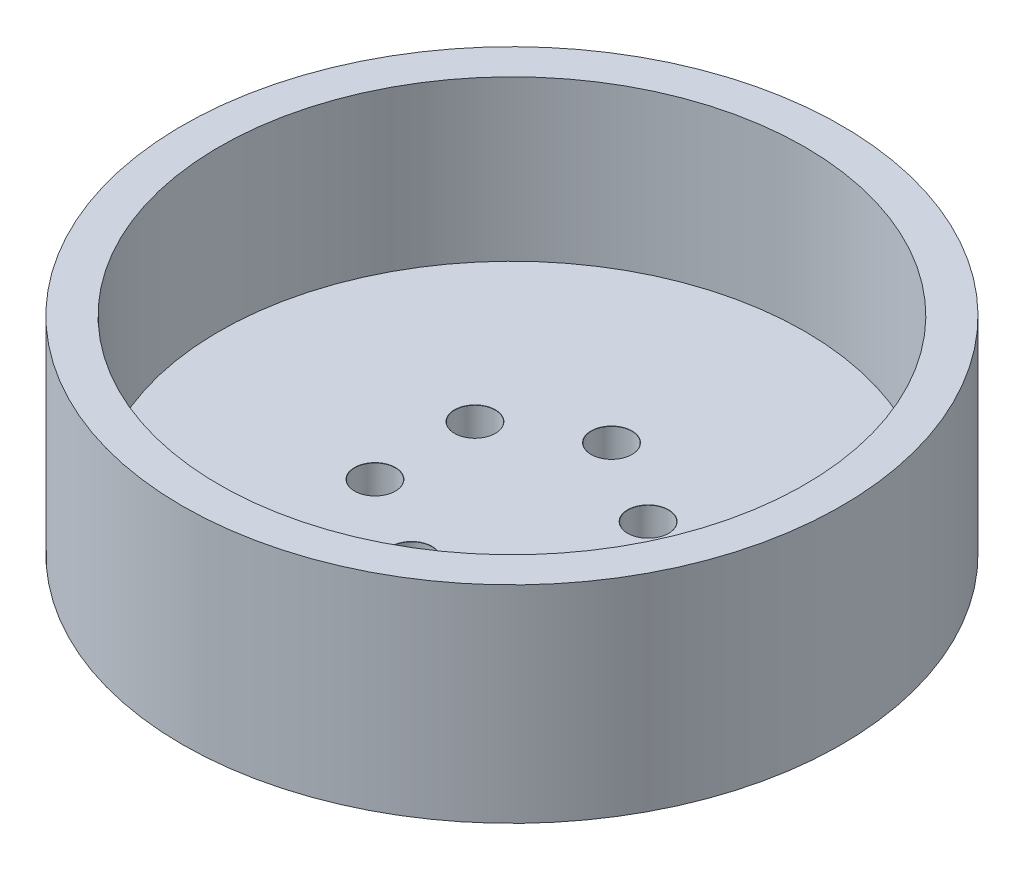
from build123d import *

# Parameters (mm, degrees)
SKETCH1_R                      = 44.675
BOSS_EXTRUDE2_DEPTH            = 6.35
M5_CLEARANCE_HOLE2_D           = 5.5
M5_CLEARANCE_HOLE2_CSINK_D     = 5.55
M5_CLEARANCE_HOLE2_CSINK_ANGLE = 90
CIRPATTERN1_COUNT              = 6
SKETCH13_R                     = 44.675
SKETCH13_R_2                   = 39.675
BOSS_EXTRUDE4_DEPTH            = 21.65


with BuildPart() as part:
    # Sketch1 → Boss-Extrude2 (new body)
    with BuildSketch(Plane(origin=(0, 0, 0), x_dir=(1, 0, 0), z_dir=(0, 1, 0))):
        with Locations(Location((0, 0, 0), (0, 0, 270))):
            Circle(SKETCH1_R)
    extrude(amount=BOSS_EXTRUDE2_DEPTH)

    # M5 Clearance Hole2 (through all)
    with Locations(Plane(origin=(0, 6.35, 0), x_dir=(1, 0, 0), z_dir=(0, 1, 0))):
        with Locations((0, 13.5)):
            m5_clearance_hole2 = CounterSinkHole(M5_CLEARANCE_HOLE2_D / 2, M5_CLEARANCE_HOLE2_CSINK_D / 2, counter_sink_angle=M5_CLEARANCE_HOLE2_CSINK_ANGLE)

    # CirPattern1: M5 Clearance Hole2 ×6 about axis
    cirpattern1_axis = Axis((0, 0, 0.0522889), (0, 1, 0))
    for i in range(1, CIRPATTERN1_COUNT):
        add(m5_clearance_hole2.rotate(cirpattern1_axis, i * 360 / CIRPATTERN1_COUNT), mode=Mode.SUBTRACT)

    # Sketch13 → Boss-Extrude4 (add)
    # profile 1 of 4: a face of its own
    with BuildSketch(Plane(origin=(0, 6.35, 0), x_dir=(1, 0, 0), z_dir=(0, 1, 0))):
        with Locations(Location((0, 0, 0), (0, 0, 270))):
            Circle(SKETCH13_R)
        with Locations(Location((0, 0, 0), (0, 0, 90))):
            Circle(SKETCH13_R_2, mode=Mode.SUBTRACT)
    # profile 2 of 4: a face of its own
    with BuildSketch(Plane(origin=(0, 6.35, 0), x_dir=(1, 0, 0), z_dir=(0, 1, 0))):
        with Locations(Location((0, 0, 0), (0, 0, 270))):
            Circle(SKETCH13_R)
        with Locations(Location((0, 0, 0), (0, 0, 90))):
            Circle(SKETCH13_R_2, mode=Mode.SUBTRACT)
    # profile 3 of 4: a face of its own
    with BuildSketch(Plane(origin=(0, 6.35, 0), x_dir=(1, 0, 0), z_dir=(0, 1, 0))):
        with Locations(Location((0, 0, 0), (0, 0, 270))):
            Circle(SKETCH13_R)
        with Locations(Location((0, 0, 0), (0, 0, 90))):
            Circle(SKETCH13_R_2, mode=Mode.SUBTRACT)
    # profile 4 of 4: a face of its own
    with BuildSketch(Plane(origin=(0, 6.35, 0), x_dir=(1, 0, 0), z_dir=(0, 1, 0))):
        with Locations(Location((0, 0, 0), (0, 0, 270))):
            Circle(SKETCH13_R)
        with Locations(Location((0, 0, 0), (0, 0, 90))):
            Circle(SKETCH13_R_2, mode=Mode.SUBTRACT)
    extrude(amount=BOSS_EXTRUDE4_DEPTH)


solid = part.part
